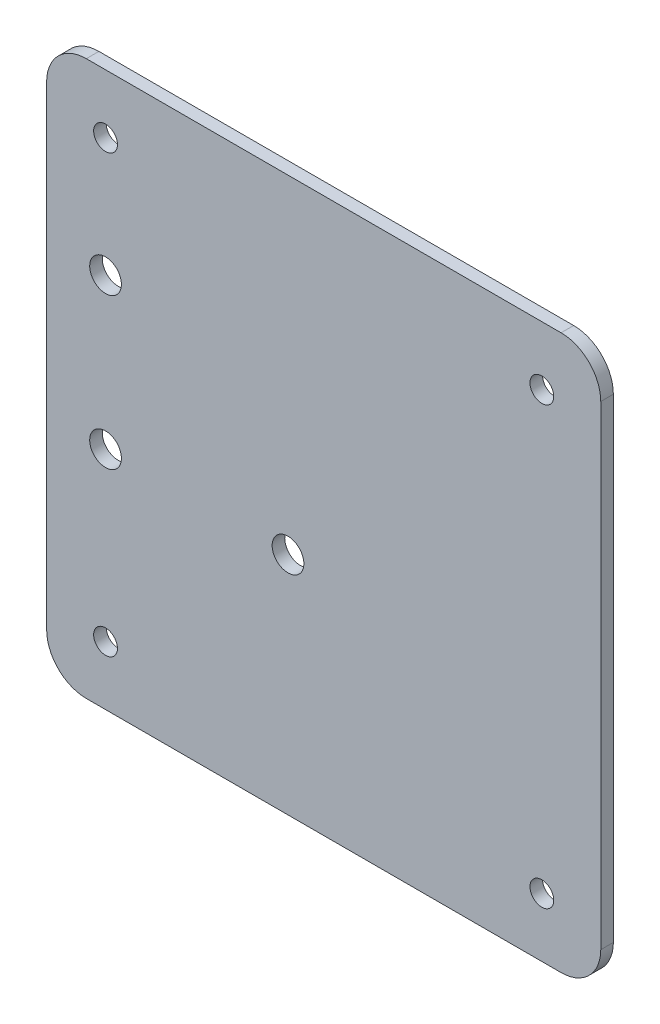
from build123d import *

# Parameters (mm, degrees)
BOSS_EXTRUDE1_DEPTH = 3.175
SKETCH2_R           = 4
SKETCH2_R_2         = 3
CUT_EXTRUDE1_DEPTH  = 1733.72226626


with BuildPart() as part:
    # Sketch1 → Boss-Extrude1 (new body)
    with BuildSketch(Plane.XY):
        with BuildLine():
            Line((66.635268781, 1721.56), (186.335268781, 1721.56))
            ThreePointArc((186.335268781, 1721.56), (193.406336593, 1718.631067812), (196.335268781, 1711.56))
            Line((196.335268781, 1711.56), (196.335268781, 1591.86))
            ThreePointArc((196.335268781, 1591.86), (193.406336593, 1584.788932188), (186.335268781, 1581.86))
            Line((186.335268781, 1581.86), (66.635268781, 1581.86))
            ThreePointArc((66.635268781, 1581.86), (59.564200969, 1584.788932188), (56.635268781, 1591.86))
            Line((56.635268781, 1591.86), (56.635268781, 1711.56))
            ThreePointArc((56.635268781, 1711.56), (59.564200969, 1718.631067812), (66.635268781, 1721.56))
        make_face()
    extrude(amount=BOSS_EXTRUDE1_DEPTH)

    # Sketch2 → Cut-Extrude1 (cut, through all)
    with BuildSketch(Plane(origin=(0, 0, 0), x_dir=(-1, 0, 0), z_dir=(0, 0, -1))):
        with Locations((-71.485268781, 1638.71)):
            Circle(SKETCH2_R)
        with Locations((-71.485268781, 1676.71)):
            Circle(SKETCH2_R)
        with Locations((-117.485268781, 1638.71)):
            Circle(SKETCH2_R)
        with Locations((-181.485268781, 1706.71)):
            Circle(SKETCH2_R_2)
        with Locations((-71.485268781, 1706.71)):
            Circle(SKETCH2_R_2)
        with Locations((-181.485268781, 1596.71)):
            Circle(SKETCH2_R_2)
        with Locations((-71.485268781, 1596.71)):
            Circle(SKETCH2_R_2)
    extrude(amount=-CUT_EXTRUDE1_DEPTH, mode=Mode.SUBTRACT)


solid = part.part
